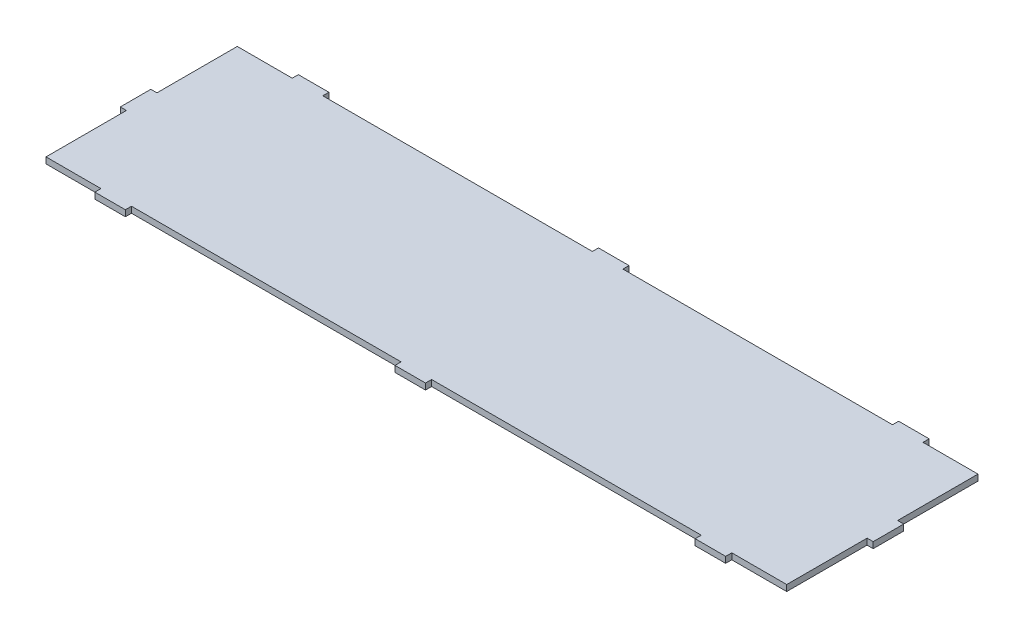
from build123d import *

# Parameters (mm, degrees)
BOSS_EXTRUDE1_DEPTH = 3


with BuildPart() as part:
    # Sketch1 → Boss-Extrude1 (new body)
    with BuildSketch(Plane(origin=(0, 0, 0), x_dir=(1, 0, 0), z_dir=(0, 1, 0))):
        Polygon((340, -100), (340, -97), (367, -97), (367, -57.5), (370, -57.5), (370, -42.5), (367, -42.5), (367, -3), (340, -3), (340, 0), (325, 0), (325, -3), (192.5, -3), (192.5, 0), (177.5, 0), (177.5, -3), (45, -3), (45, 0), (30, 0), (30, -3), (3, -3), (3, -42.5), (0, -42.5), (0, -57.5), (3, -57.5), (3, -97), (30, -97), (30, -100), (45, -100), (45, -97), (177.5, -97), (177.5, -100), (192.5, -100), (192.5, -97), (325, -97), (325, -100), align=None)
    extrude(amount=BOSS_EXTRUDE1_DEPTH)


solid = part.part
